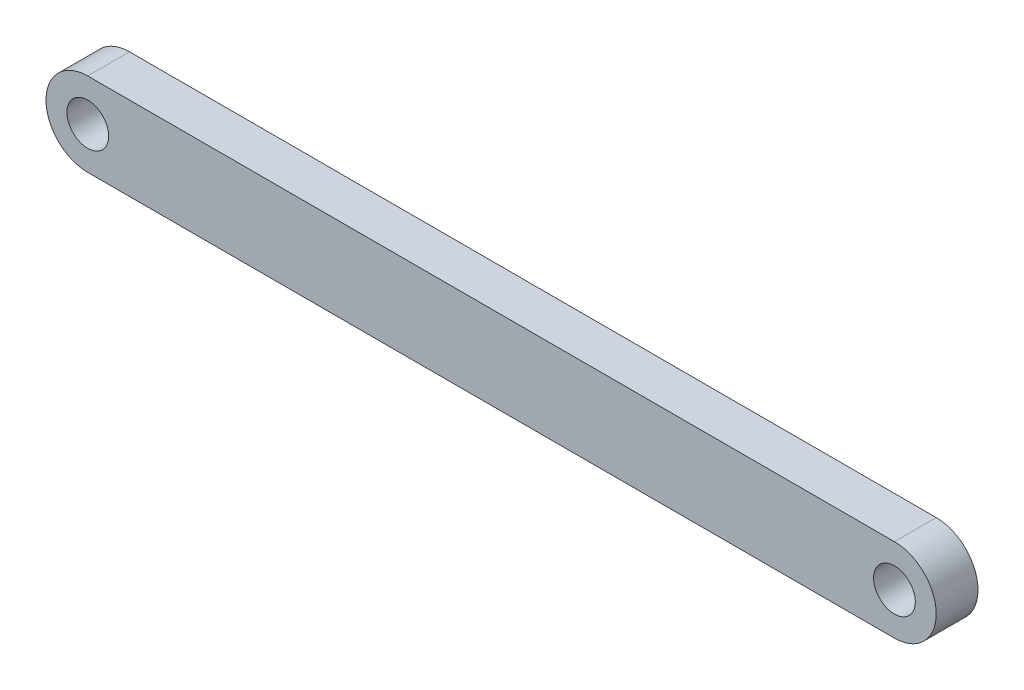
from build123d import *

# Parameters (mm, degrees)
ESBO_O1_R                = 2.5
RESSALTO_EXTRUS_O1_DEPTH = 5


with BuildPart() as part:
    # Esboço1 → Ressalto-extrusão1 (new body)
    with BuildSketch(Plane.XY):
        with BuildLine():
            Line((-83.96, 5), (12.58, 5))
            ThreePointArc((12.58, 5), (17.58, 0), (12.58, -5))
            Line((12.58, -5), (-83.96, -5))
            ThreePointArc((-83.96, -5), (-88.96, 0), (-83.96, 5))
        make_face()
        with Locations((-83.96, 0)):
            Circle(ESBO_O1_R, mode=Mode.SUBTRACT)
        with Locations((12.58, 0)):
            Circle(ESBO_O1_R, mode=Mode.SUBTRACT)
    extrude(amount=RESSALTO_EXTRUS_O1_DEPTH)


solid = part.part
